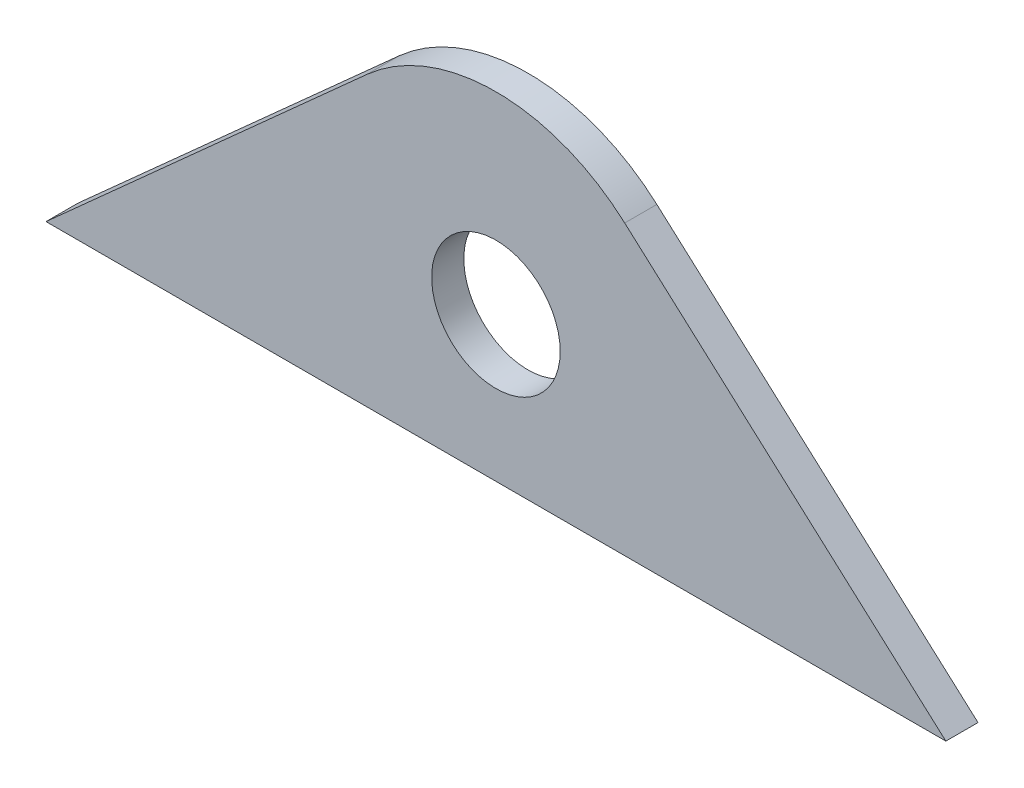
from build123d import *

# Parameters (mm, degrees)
SKETCH1_R      = 6.35
EXTRUDE1_DEPTH = 3.175


with BuildPart() as part:
    # Sketch1 → Extrude1 (new body)
    with BuildSketch(Plane.XY):
        with BuildLine():
            Line((-12.721942116, 28.466875473), (-44.45, 0))
            Line((-44.45, 0), (44.45, 0))
            Line((44.45, 0), (12.721942116, 28.466875473))
            ThreePointArc((12.721942116, 28.466875473), (0, 33.3375), (-12.721942116, 28.466875473))
        make_face()
        with Locations((0, 14.2875)):
            Circle(SKETCH1_R, mode=Mode.SUBTRACT)
    extrude(amount=EXTRUDE1_DEPTH)


solid = part.part
